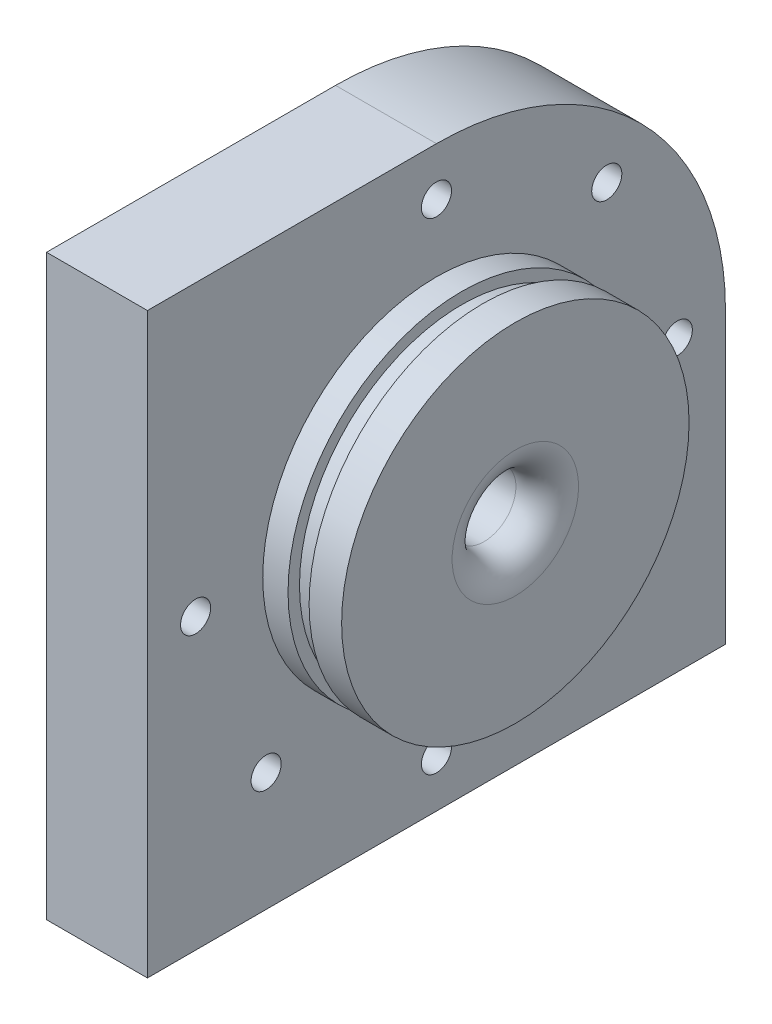
from build123d import *

# Parameters (mm, degrees)
SKETCH1_R                     = 36.6395
HOUSING_FITTING_EXTRUDE_DEPTH = 16.637
HOUSING_BODY_1_DEPTH          = 21.2852
SKETCH3_R                     = 6.731
IMPELLER_BORE_DEPTH           = 17.018
SKETCH4_R                     = 4
SHAFT_BORE_DEPTH              = 20.9042
O_RING_CUT_DEPTH              = 1.27
O_RING_CUT_DEPTH_BACK         = 3.175
SKETCH5_R                     = 36.6395
SKETCH5_R_2                   = 34.2265
SKETCH12_R                    = 3.175
CUT_EXTRUDE2_DEPTH            = 21.2852
CIRPATTERN1_COUNT             = 8
SKETCH14_R                    = 2.5796875
CUT_EXTRUDE4_DEPTH            = 16.51
SKETCH15_R                    = 2.5796875
CUT_EXTRUDE5_DEPTH            = 10.922
FILLET1_R                     = 6.604
SKETCH17_R                    = 17.5006
CUT_EXTRUDE8_DEPTH            = 25.2222
SKETCH18_R                    = 24.9174
CUT_EXTRUDE9_DEPTH            = 15.3162
SKETCH19_R                    = 1.7272
CUT_EXTRUDE10_DEPTH           = 9.525


with BuildPart() as part:
    # Sketch1 → Housing Fitting Extrude (new body)
    with BuildSketch(Plane(origin=(0, 0, 0), x_dir=(0, 0, -1), z_dir=(1, 0, 0))):
        Circle(SKETCH1_R)
    extrude(amount=HOUSING_FITTING_EXTRUDE_DEPTH)

    # Sketch2 → Housing Body 1 (add)
    with BuildSketch(Plane.ZY):
        with BuildLine():
            Line((60.96, 0), (60.96, 60.96))
            Line((60.96, 60.96), (0, 60.96))
            ThreePointArc((0, 60.96), (-43.105229381, 43.105229381), (-60.96, 0))
            Line((-60.96, 0), (-60.96, -54.61))
            Line((-60.96, -54.61), (-60.96, -60.96))
            Line((-60.96, -60.96), (60.96, -60.96))
            Line((60.96, -60.96), (60.96, -54.61))
            Line((60.96, -54.61), (60.96, 0))
        make_face()
    extrude(amount=HOUSING_BODY_1_DEPTH)

    # Sketch3 → Impeller Bore (cut)
    with BuildSketch(Plane(origin=(16.637, 0, 0), x_dir=(0, 0, -1), z_dir=(1, 0, 0))):
        Circle(SKETCH3_R)
    extrude(amount=-IMPELLER_BORE_DEPTH, mode=Mode.SUBTRACT)

    # Sketch4 → Shaft Bore (cut)
    with BuildSketch(Plane(origin=(-0.381, 0, 0), x_dir=(0, 0, -1), z_dir=(1, 0, 0))):
        Circle(SKETCH4_R)
    extrude(amount=-SHAFT_BORE_DEPTH, mode=Mode.SUBTRACT)

    # Sketch5 → O-Ring Cut (cut, two sides: drawn at the far end of the back side and taken through both)
    with BuildSketch(Plane(origin=(8.509, 0, 0), x_dir=(0, 0, -1), z_dir=(1, 0, 0)).offset(-O_RING_CUT_DEPTH_BACK)):
        Circle(SKETCH5_R)
        Circle(SKETCH5_R_2, mode=Mode.SUBTRACT)
    extrude(amount=O_RING_CUT_DEPTH + O_RING_CUT_DEPTH_BACK, mode=Mode.SUBTRACT)

    # Sketch12 → Cut-Extrude2 (cut)
    with BuildSketch(Plane(origin=(0, 0, 0), x_dir=(0, 0, -1), z_dir=(1, 0, 0))):
        with Locations((-50.8, 0)):
            Circle(SKETCH12_R)
    cut_extrude2 = extrude(amount=-CUT_EXTRUDE2_DEPTH, mode=Mode.SUBTRACT)

    # CirPattern1: Cut-Extrude2 ×8 about axis, 1 skipped
    cirpattern1_axis = Axis((0, 0, 0), (1, 0, 0))
    add([cut_extrude2.rotate(cirpattern1_axis, i * 360 / CIRPATTERN1_COUNT) for i in range(1, CIRPATTERN1_COUNT) if i not in (7,)], mode=Mode.SUBTRACT)

    # Sketch14 → Cut-Extrude4 (cut)
    with BuildSketch(Plane.XZ.offset(60.96)):
        with Locations(Location((-8.128, -46.754349092, 0), (0, 0, 270))):
            Circle(SKETCH14_R)
        with Locations(Location((-8.128, 41.914080666, 0), (0, 0, 270))):
            Circle(SKETCH14_R)
    extrude(amount=-CUT_EXTRUDE4_DEPTH, mode=Mode.SUBTRACT)

    # Sketch15 → Cut-Extrude5 (cut)
    with BuildSketch(Plane(origin=(0, 0, -60.96), x_dir=(-1, 0, 0), z_dir=(0, 0, -1))):
        with Locations(Location((8.128, -39.337514031, 0), (0, 0, 90))):
            Circle(SKETCH15_R)
    extrude(amount=-CUT_EXTRUDE5_DEPTH, mode=Mode.SUBTRACT)

    # Fillet1
    fillet1_edges = [part.edges().sort_by_distance(p)[0] for p in [
        (16.637, 0, 6.731),
    ]]
    fillet(fillet1_edges, radius=FILLET1_R)

    # Sketch17 → Cut-Extrude8 (cut)
    with BuildSketch(Plane.ZY.offset(21.2852)):
        Circle(SKETCH17_R)
    extrude(amount=-CUT_EXTRUDE8_DEPTH, mode=Mode.SUBTRACT)

    # Sketch18 → Cut-Extrude9 (cut)
    with BuildSketch(Plane.ZY.offset(21.2852)):
        Circle(SKETCH18_R)
    extrude(amount=-CUT_EXTRUDE9_DEPTH, mode=Mode.SUBTRACT)

    # Sketch19 → Cut-Extrude10 (cut)
    with BuildSketch(Plane.ZY.offset(21.2852)):
        with Locations((0, 28.575)):
            Circle(SKETCH19_R)
        with Locations((28.575, 0)):
            Circle(SKETCH19_R)
        with Locations((0, -28.575)):
            Circle(SKETCH19_R)
        with Locations((-28.575, 0)):
            Circle(SKETCH19_R)
    extrude(amount=-CUT_EXTRUDE10_DEPTH, mode=Mode.SUBTRACT)


solid = part.part
